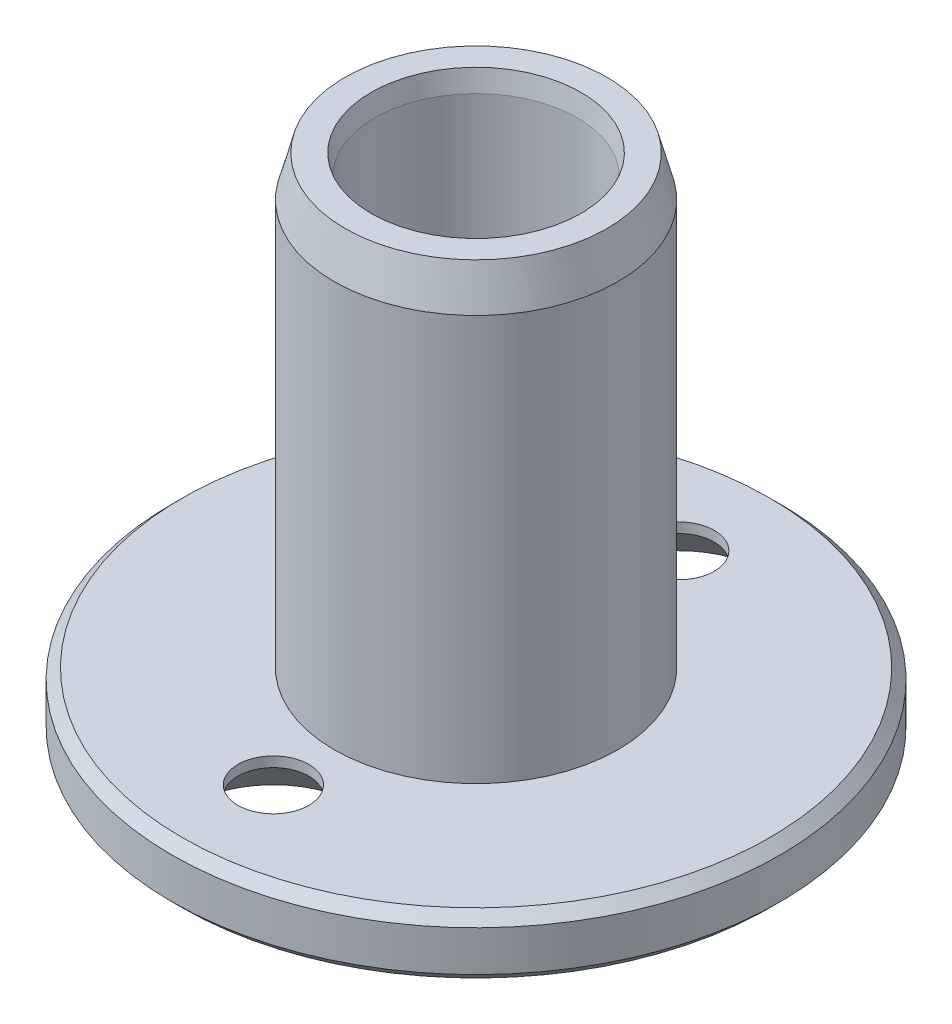
from build123d import *

# Parameters (mm, degrees)
SKETCH_1_R                   = 15
SKETCH_1_R_2                 = 5
EXTRUDE_1_DEPTH              = 3
SKETCH_1_3_R                 = 7
SKETCH_1_3_R_2               = 5
EXTRUDE_2_DEPTH              = 25
SKETCH_2_R                   = 1.75
CUT_EXTRUDE_1_DEPTH          = 33.787192622
CHAMFER_1_SIZE               = 2.5
CHAMFER_1_OF_MIRROR_659_SIZE = 2.5
CHAMFER_2_SIZE               = 2
CHAMFER_2_SIZE2              = 0.535898385
CHAMFER_4_SIZE               = 1
CHAMFER_4_SIZE2              = 0.176326981
CHAMFER_5_SIZE               = 0.5


with BuildPart() as part:
    # 草图1 → 凸台-拉伸1 (new body)
    with BuildSketch(Plane(origin=(0, 0, 0), x_dir=(1, 0, 0), z_dir=(0, 1, 0))):
        Circle(SKETCH_1_R)
        Circle(SKETCH_1_R_2, mode=Mode.SUBTRACT)
    extrude(amount=EXTRUDE_1_DEPTH)

    # 草图1<3> → 凸台-拉伸2 (add)
    with BuildSketch(Plane(origin=(0, 0, 0), x_dir=(1, 0, 0), z_dir=(0, 1, 0))):
        Circle(SKETCH_1_3_R)
        Circle(SKETCH_1_3_R_2, mode=Mode.SUBTRACT)
    extrude(amount=EXTRUDE_2_DEPTH)

    # 草图2 → 切除-拉伸1 (cut, through all)
    with BuildSketch(Plane.XZ):
        with Locations((0, 10)):
            Circle(SKETCH_2_R)
    cut_extrude_1 = extrude(amount=-CUT_EXTRUDE_1_DEPTH, mode=Mode.SUBTRACT)

    # 倒角1
    chamfer_1_edges = [part.edges().sort_by_distance(p)[0] for p in [
        (-1.75, 0, 10),
    ]]
    chamfer(chamfer_1_edges, length=CHAMFER_1_SIZE)

    # Mirror 659: 切除-拉伸1 across plane
    add(cut_extrude_1.mirror(Plane.XY), mode=Mode.SUBTRACT)

    # 倒角1 of Mirror 659
    chamfer_1_of_mirror_659_edges = [part.edges().sort_by_distance(p)[0] for p in [
        (-1.75, 0, -10),
    ]]
    chamfer(chamfer_1_of_mirror_659_edges, length=CHAMFER_1_OF_MIRROR_659_SIZE)

    # 倒角2
    chamfer_2_edges = [part.edges().sort_by_distance(p)[0] for p in [
        (-7, 25, 0),
    ]]
    chamfer_2_side = [part.faces().sort_by_distance(p)[0] for p in [
        (-7, 14, 0),
    ]]
    chamfer(chamfer_2_edges, length=CHAMFER_2_SIZE, length2=CHAMFER_2_SIZE2, reference=chamfer_2_side[0])

    # 倒角4
    chamfer_4_edges = [part.edges().sort_by_distance(p)[0] for p in [
        (-5, 0, 0),
        (-5, 25, 0),
    ]]
    chamfer_4_side = [part.faces().sort_by_distance(p)[0] for p in [
        (-5, 12.5, 0),
    ]]
    chamfer(chamfer_4_edges, length=CHAMFER_4_SIZE, length2=CHAMFER_4_SIZE2, reference=chamfer_4_side[0])

    # 倒角5
    chamfer_5_edges = [part.edges().sort_by_distance(p)[0] for p in [
        (-15, 0, 0),
        (-15, 3, 0),
    ]]
    chamfer(chamfer_5_edges, length=CHAMFER_5_SIZE)


solid = part.part
